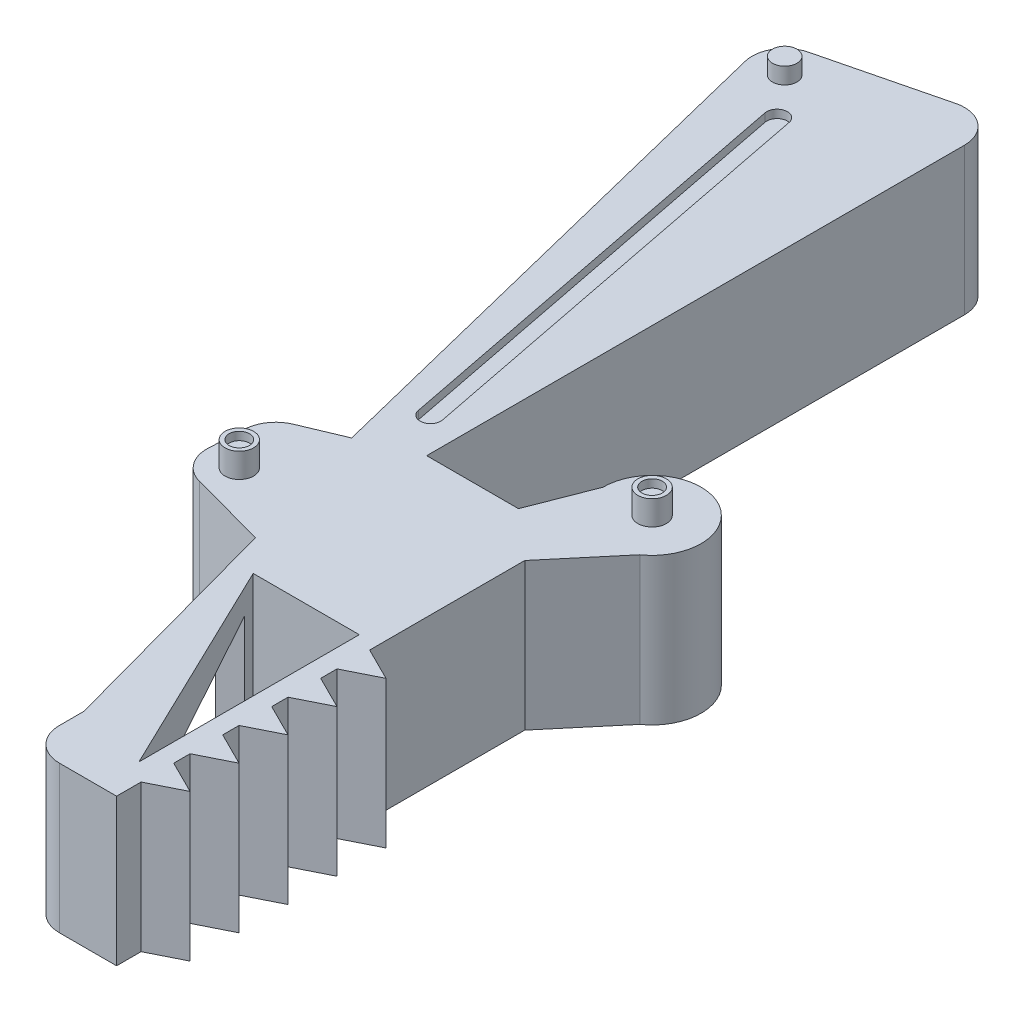
from build123d import *

# Parameters (mm, degrees)
BOSS_EXTRUDE1_DEPTH = 18
FILLET2_R           = 4
BOSS_EXTRUDE2_DEPTH = 18
LPATTERN1_COUNT     = 5
LPATTERN1_PITCH     = 6
CUT_EXTRUDE1_DEPTH  = 26
CUT_EXTRUDE2_DEPTH  = 8
SKETCH6_R           = 1.75
BOSS_EXTRUDE3_DEPTH = 3
SKETCH7_R           = 1.25
CUT_EXTRUDE4_DEPTH  = 1
SKETCH8_R           = 1.25
CUT_EXTRUDE5_DEPTH  = 1
CUT_EXTRUDE6_DEPTH  = 1
SKETCH5_R           = 1.5
BOSS_EXTRUDE4_DEPTH = 2


with BuildPart() as part:
    # Sketch1 → Boss-Extrude1 (new body)
    with BuildSketch(Plane(origin=(0, 0, 0), x_dir=(1, 0, 0), z_dir=(0, 1, 0))):
        Polygon((-40.969304311, -73.71633288), (-34.496108293, -71), (-34.496108293, 0), (-57.792675156, -5.768012861), align=None)
        with BuildLine():
            Line((-23.247974987, -71), (-34.496108293, -71))
            Line((-34.496108293, -71), (-40.969304311, -73.71633288))
            Line((-40.969304311, -73.71633288), (-48.327677264, -76.804110593))
            Line((-48.327677264, -76.804110593), (-48.838396363, -86.791060378))
            Line((-48.838396363, -86.791060378), (-36.286676362, -90.175484262))
            Line((-36.286676362, -90.175484262), (-28.369724317, -119.111998743))
            Line((-28.369724317, -119.111998743), (-28.369724317, -126.111998743))
            Line((-28.369724317, -126.111998743), (-17.369724317, -126.111998743))
            Line((-17.369724317, -126.111998743), (-17.369724317, -76.111998743))
            Line((-17.369724317, -76.111998743), (-10.936329958, -68.456188073))
            ThreePointArc((-10.936329958, -68.456188073), (-11.590696078, -58.200883887), (-20.355503093, -63.56536121))
            Line((-20.355503093, -63.56536121), (-23.247974987, -71))
        make_face()
    extrude(amount=BOSS_EXTRUDE1_DEPTH)

    # Fillet2
    fillet2_edges = [part.edges().sort_by_distance(p)[0] for p in [
        (-57.792675156, 9, 5.768012861),
        (-34.496108293, 9, 0),
        (-28.369724317, 9, 126.111998743),
        (-48.838396363, 9, 86.791060378),
        (-48.327677264, 9, 76.804110593),
    ]]
    fillet(fillet2_edges, radius=FILLET2_R)

    # Sketch2 → Boss-Extrude2 (add, through all)
    with BuildSketch(Plane(origin=(0, 18, 0), x_dir=(1, 0, 0), z_dir=(0, 1, 0))):
        Polygon((-17.369724317, -119.111998743), (-17.369724317, -123.111998743), (-13.369724317, -121.111998743), align=None)
    boss_extrude2 = extrude(amount=-BOSS_EXTRUDE2_DEPTH)

    # LPattern1: Boss-Extrude2 ×5
    with Locations(*[(0, 0, -i * LPATTERN1_PITCH) for i in range(1, LPATTERN1_COUNT)]):
        add(boss_extrude2)

    # Sketch3 → Cut-Extrude1 (cut)
    with BuildSketch(Plane(origin=(0, 18, 0), x_dir=(1, 0, 0), z_dir=(0, 1, 0))):
        Polygon((-19.631839037, -121.116880753), (-19.631839037, -94.116880753), (-32.631839037, -94.116880753), align=None)
    extrude(amount=-CUT_EXTRUDE1_DEPTH, mode=Mode.SUBTRACT)

    # Sketch4 → Cut-Extrude2 (cut)
    with BuildSketch(Plane(origin=(-56.713154452, 0, 15.516565563), x_dir=(0.2638984014912162, 0, 0.9645504827070385), z_dir=(-0.9645504827070386, 0, 0.2638984014912162))):
        Polygon((84.402810986, 15), (84.402810986, 3), (102.402810986, 5.456363489), (102.402810986, 12.543636511), align=None)
    extrude(amount=-CUT_EXTRUDE2_DEPTH, mode=Mode.SUBTRACT)

    # Sketch6 → Boss-Extrude3 (add)
    with BuildSketch(Plane(origin=(0, 18, 0), x_dir=(1, 0, 0), z_dir=(0, 1, 0))):
        with Locations(Location((-14.355633277, -63.525836684, 0), (0, 0, 270))):
            Circle(SKETCH6_R)
        with Locations(Location((-44.67866751, -83.769823901, 0), (0, 0, 270))):
            Circle(SKETCH6_R)
    extrude(amount=BOSS_EXTRUDE3_DEPTH)

    # Sketch7 → Cut-Extrude4 (cut)
    with BuildSketch(Plane(origin=(0, 21, 0), x_dir=(1, 0, 0), z_dir=(0, 1, 0))):
        with Locations(Location((-14.355633277, -63.525836684, 0), (0, 0, 270))):
            Circle(SKETCH7_R)
    extrude(amount=-CUT_EXTRUDE4_DEPTH, mode=Mode.SUBTRACT)

    # Sketch8 → Cut-Extrude5 (cut)
    with BuildSketch(Plane(origin=(0, 21, 0), x_dir=(1, 0, 0), z_dir=(0, 1, 0))):
        with Locations(Location((-44.67866751, -83.769823901, 0), (0, 0, 270))):
            Circle(SKETCH8_R)
    extrude(amount=-CUT_EXTRUDE5_DEPTH, mode=Mode.SUBTRACT)

    # Sketch9 → Cut-Extrude6 (cut)
    with BuildSketch(Plane(origin=(0, 18, 0), x_dir=(1, 0, 0), z_dir=(0, 1, 0))):
        with BuildLine():
            Line((-47.653198818, -13.430984589), (-37.315061162, -66.229330476))
            ThreePointArc((-37.315061162, -66.229330476), (-38.31592464, -67.717570951), (-39.804165115, -66.716707473))
            Line((-39.804165115, -66.716707473), (-50.142302771, -13.918361587))
            ThreePointArc((-50.142302771, -13.918361587), (-49.141439293, -12.430121111), (-47.653198818, -13.430984589))
        make_face()
    extrude(amount=-CUT_EXTRUDE6_DEPTH, mode=Mode.SUBTRACT)

    # Sketch5 → Boss-Extrude4 (add)
    with BuildSketch(Plane(origin=(0, 18, 0), x_dir=(1, 0, 0), z_dir=(0, 1, 0))):
        with Locations(Location((-52.948578536, -8.689438528, 0), (0, 0, 270))):
            Circle(SKETCH5_R)
    boss_extrude4 = extrude(amount=BOSS_EXTRUDE4_DEPTH)

    # Mirror1: Boss-Extrude4 across plane
    add(boss_extrude4.mirror(Plane.ZX.offset(9)))


solid = part.part
